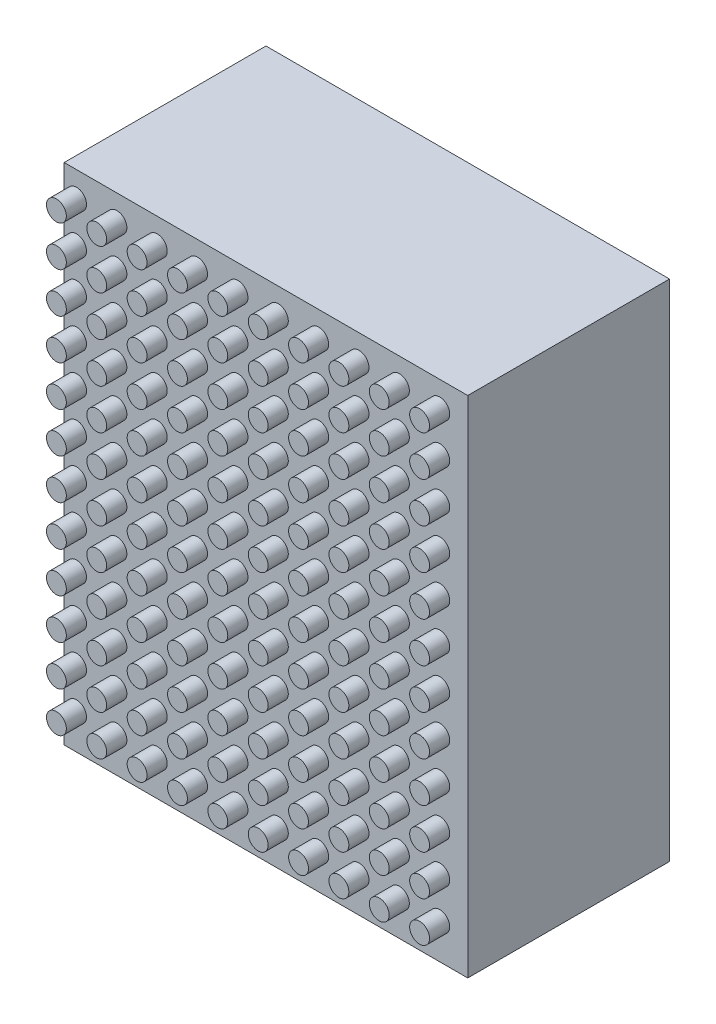
from build123d import *

# Parameters (mm, degrees)
SKETCH1_W            = 40
SKETCH1_H            = 50
BOSS_EXTRUDE1_DEPTH  = 20
SKETCH2_R            = 0.984806745
BOSS_EXTRUDE2_DEPTH  = 2
LPATTERN1_COUNT      = 10
LPATTERN1_PITCH      = 4
LPATTERN1_COUNT_DIR2 = 12
LPATTERN1_PITCH_DIR2 = 4


with BuildPart() as part:
    # Sketch1 → Boss-Extrude1 (new body)
    with BuildSketch(Plane.XY):
        Rectangle(SKETCH1_W, SKETCH1_H)
    extrude(amount=BOSS_EXTRUDE1_DEPTH)

    # Sketch2 → Boss-Extrude2 (add)
    with BuildSketch(Plane.XY.offset(20)):
        with Locations(Location((17.228634816, 22.502049968, 0), (0, 0, 180))):
            Circle(SKETCH2_R)
    boss_extrude2 = extrude(amount=BOSS_EXTRUDE2_DEPTH)

    # LPattern1: Boss-Extrude2 10 × 12
    with Locations(*[(-i * LPATTERN1_PITCH, -j * LPATTERN1_PITCH_DIR2, 0) for i in range(LPATTERN1_COUNT) for j in range(LPATTERN1_COUNT_DIR2) if (i, j) != (0, 0)]):
        add(boss_extrude2)


solid = part.part
